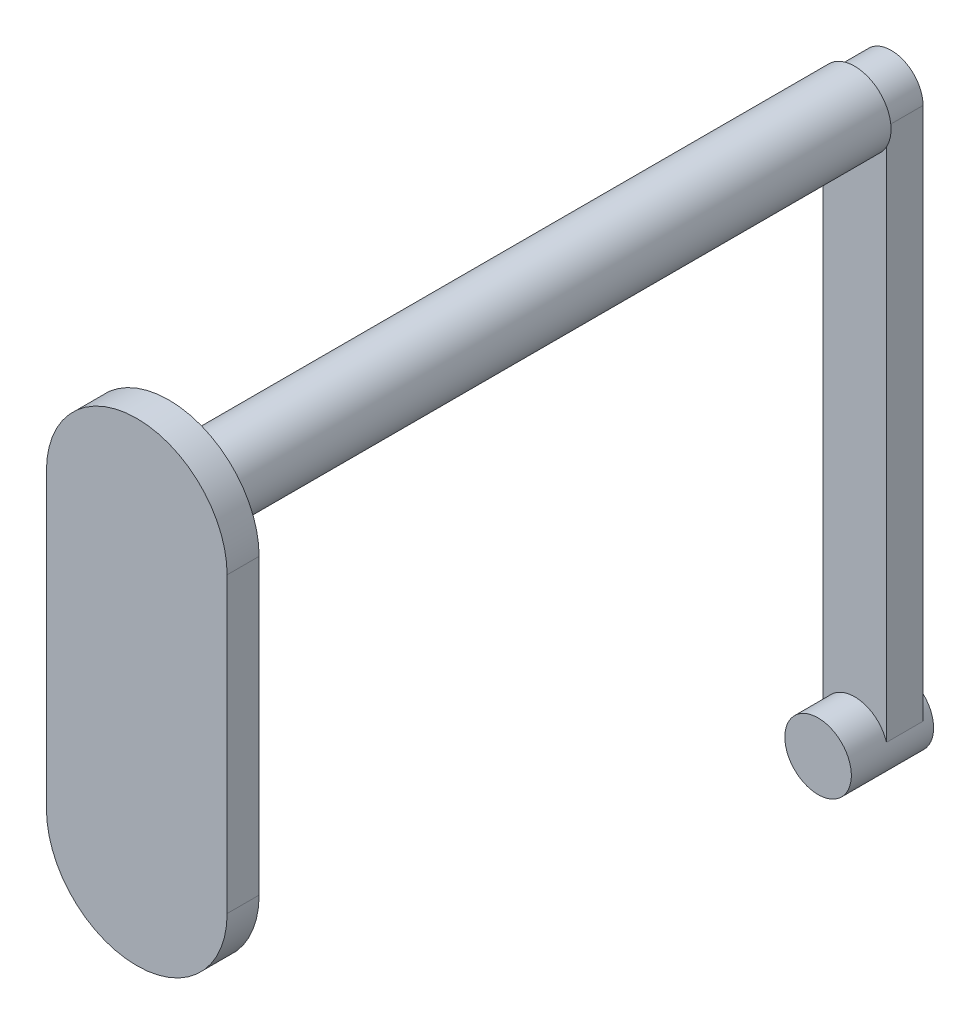
from build123d import *

# Parameters (mm, degrees)
EXTRUDE_1_DEPTH      = 7
SKETCH_3_R           = 7.951035335
EXTRUDE_2_DEPTH      = 150
EXTRUDE_3_DEPTH      = 8
EXTRUDE_4_DEPTH      = 2
EXTRUDE_4_DEPTH_BACK = 16
SKETCH_5_R           = 7.270551731


with BuildPart() as part:
    # 草图1 → 凸台-拉伸1 (new body)
    with BuildSketch(Plane.XY):
        with BuildLine():
            Line((-19.757797481, 54.586532616), (-19.757797481, 118.7433895))
            ThreePointArc((-19.757797481, 118.7433895), (0, 138.50118698), (19.757797481, 118.7433895))
            Line((19.757797481, 118.7433895), (19.757797481, 54.586532616))
            ThreePointArc((19.757797481, 54.586532616), (0, 34.828735136), (-19.757797481, 54.586532616))
        make_face()
    extrude(amount=-EXTRUDE_1_DEPTH)

    # 草图3 → 凸台-拉伸2 (add)
    with BuildSketch(Plane(origin=(0, 0, -7), x_dir=(-1, 0, 0), z_dir=(0, 0, -1))):
        with Locations(Location((0, 118.7433895, 0), (0, 0, 180))):
            Circle(SKETCH_3_R)
    extrude(amount=EXTRUDE_2_DEPTH)

    # 草图4 → 凸台-拉伸3 (add)
    with BuildSketch(Plane(origin=(0, 0, -157), x_dir=(-1, 0, 0), z_dir=(0, 0, -1))):
        with BuildLine():
            Line((6.958683776, 118.7433895), (6.958683776, 0))
            ThreePointArc((6.958683776, 0), (0, -6.958683776), (-6.958683776, 0))
            Line((-6.958683776, 0), (-6.958683776, 118.7433895))
            ThreePointArc((-6.958683776, 118.7433895), (0, 125.702073275), (6.958683776, 118.7433895))
        make_face()
    extrude(amount=EXTRUDE_3_DEPTH)

    # 草图5 → 凸台-拉伸4 (add, two sides: drawn at the far end of the back side and taken through both)
    with BuildSketch(Plane(origin=(0, 0, -165), x_dir=(-1, 0, 0), z_dir=(0, 0, -1)).offset(-EXTRUDE_4_DEPTH_BACK)):
        Circle(SKETCH_5_R)
    extrude(amount=EXTRUDE_4_DEPTH + EXTRUDE_4_DEPTH_BACK)


solid = part.part
